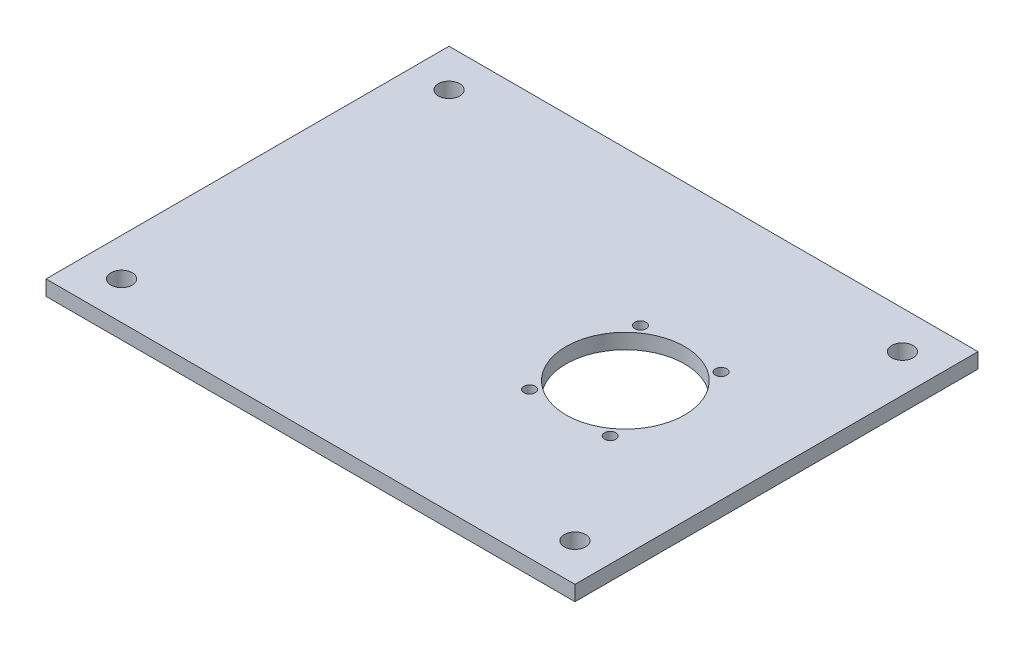
from build123d import *

# Parameters (mm, degrees)
SKETCH1_W           = 210
SKETCH1_H           = 160
SKETCH1_R           = 23.55
SKETCH1_R_2         = 4.25
SKETCH1_R_3         = 2.25
PLATE_EXTRUDE_DEPTH = 6


with BuildPart() as part:
    # Sketch1 → Plate_Extrude (new body)
    with BuildSketch(Plane(origin=(0, 0, 0), x_dir=(1, 0, 0), z_dir=(0, 1, 0))):
        Rectangle(SKETCH1_W, SKETCH1_H)
        with Locations(Location((45, 0, 0), (0, 0, 270))):
            Circle(SKETCH1_R, mode=Mode.SUBTRACT)
        with Locations(Location((-90, -65, 0), (0, 0, 270))):
            Circle(SKETCH1_R_2, mode=Mode.SUBTRACT)
        with Locations(Location((90, -65, 0), (0, 0, 270))):
            Circle(SKETCH1_R_2, mode=Mode.SUBTRACT)
        with Locations(Location((-90, 65, 0), (0, 0, 270))):
            Circle(SKETCH1_R_2, mode=Mode.SUBTRACT)
        with Locations(Location((90, 65, 0), (0, 0, 270))):
            Circle(SKETCH1_R_2, mode=Mode.SUBTRACT)
        with Locations(Location((29, -22, 0), (0, 0, 270))):
            Circle(SKETCH1_R_3, mode=Mode.SUBTRACT)
        with Locations(Location((61, -22, 0), (0, 0, 270))):
            Circle(SKETCH1_R_3, mode=Mode.SUBTRACT)
        with Locations(Location((29, 22, 0), (0, 0, 270))):
            Circle(SKETCH1_R_3, mode=Mode.SUBTRACT)
        with Locations(Location((61, 22, 0), (0, 0, 270))):
            Circle(SKETCH1_R_3, mode=Mode.SUBTRACT)
    extrude(amount=PLATE_EXTRUDE_DEPTH)


solid = part.part
